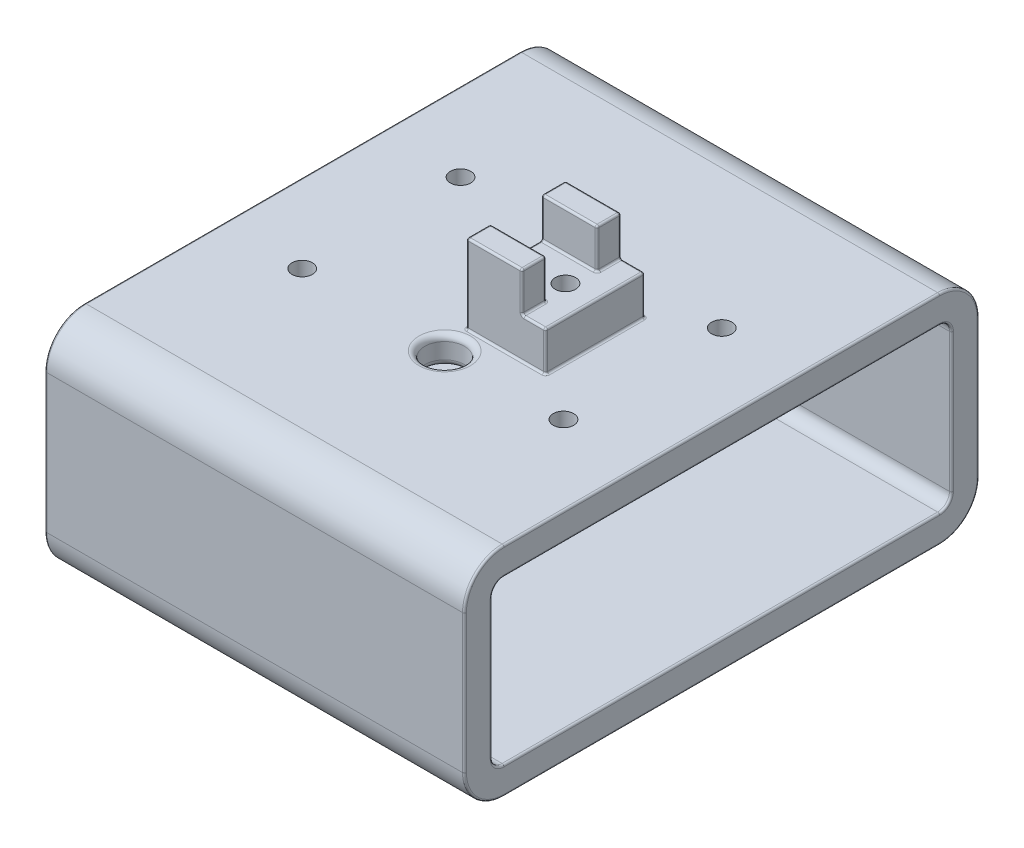
from build123d import *

# Parameters (mm, degrees)
BOSS_EXTRUDE1_DEPTH = 106
SHELL1_T            = -7
SKETCH2_W           = 20
SKETCH2_H           = 25
BOSS_EXTRUDE2_DEPTH = 10
SKETCH3_W           = 14.041332882
SKETCH3_H           = 6.05
BOSS_EXTRUDE3_DEPTH = 10
SKETCH4_R           = 2.575
CUT_EXTRUDE1_DEPTH  = 17
SKETCH5_R           = 2.575
CUT_EXTRUDE2_DEPTH  = 7
FILLET1_R           = 0.5
SKETCH6_W           = 14.6
SKETCH6_H           = 8.42
CUT_EXTRUDE3_DEPTH  = 7
SKETCH7_R           = 5
CUT_EXTRUDE4_DEPTH  = 7
SKETCH8_R           = 6
CUT_EXTRUDE5_DEPTH  = 7
FILLET2_R           = 0.5
FILLET4_R           = 1.5


with BuildPart() as part:
    # Sketch1 → Boss-Extrude1 (new body)
    with BuildSketch(Plane(origin=(0, 0, 0), x_dir=(0, 0, -1), z_dir=(1, 0, 0))):
        with BuildLine():
            Line((-10, 0), (-120, 0))
            ThreePointArc((-120, 0), (-127.071067812, -2.928932188), (-130, -10))
            Line((-130, -10), (-130, -45))
            ThreePointArc((-130, -45), (-127.071067812, -52.071067812), (-120, -55))
            Line((-120, -55), (-10, -55))
            ThreePointArc((-10, -55), (-2.928932188, -52.071067812), (0, -45))
            Line((0, -45), (0, -10))
            ThreePointArc((0, -10), (-2.928932188, -2.928932188), (-10, 0))
        make_face()
    extrude(amount=BOSS_EXTRUDE1_DEPTH)

    # Shell1
    shell1_openings = [part.faces().sort_by_distance(p)[0] for p in [
        (106, -27.5, 65),
    ]]
    offset(amount=SHELL1_T, openings=shell1_openings, kind=Kind.INTERSECTION)

    # Sketch2 → Boss-Extrude2 (add)
    with BuildSketch(Plane(origin=(0, 0, 0), x_dir=(1, 0, 0), z_dir=(0, 1, 0))):
        with Locations((64, -65)):
            Rectangle(SKETCH2_W, SKETCH2_H)
    extrude(amount=BOSS_EXTRUDE2_DEPTH)

    # Sketch3 → Boss-Extrude3 (add)
    with BuildSketch(Plane(origin=(0, 10, 0), x_dir=(1, 0, 0), z_dir=(0, 1, 0))):
        with Locations((61.020666441, -74.475)):
            Rectangle(SKETCH3_W, SKETCH3_H)
        with Locations((61.020666441, -55.525)):
            Rectangle(SKETCH3_W, SKETCH3_H)
    extrude(amount=BOSS_EXTRUDE3_DEPTH)

    # Sketch4 → Cut-Extrude1 (cut)
    with BuildSketch(Plane(origin=(0, 10, 0), x_dir=(1, 0, 0), z_dir=(0, 1, 0))):
        with Locations(Location((66.5, -65, 0), (0, 0, 270))):
            Circle(SKETCH4_R)
    extrude(amount=-CUT_EXTRUDE1_DEPTH, mode=Mode.SUBTRACT)

    # Sketch5 → Cut-Extrude2 (cut)
    with BuildSketch(Plane(origin=(0, 0, 0), x_dir=(1, 0, 0), z_dir=(0, 1, 0))):
        with Locations(Location((20, -85, 0), (0, 0, 270))):
            Circle(SKETCH5_R)
        with Locations(Location((20, -45, 0), (0, 0, 270))):
            Circle(SKETCH5_R)
        with Locations(Location((86, -45, 0), (0, 0, 270))):
            Circle(SKETCH5_R)
        with Locations(Location((86, -85, 0), (0, 0, 270))):
            Circle(SKETCH5_R)
    extrude(amount=-CUT_EXTRUDE2_DEPTH, mode=Mode.SUBTRACT)

    # Fillet1
    fillet1_edges = [part.edges().sort_by_distance(p)[0] for p in [
        (74, 0, 65),
        (74, 5, 77.5),
        (64, 0, 52.5),
        (74, 5, 52.5),
        (54, 0, 65),
        (54, 10, 52.5),
        (64, 0, 77.5),
        (54, 10, 77.5),
        (74, 10, 65),
        (71.020666441, 10, 52.5),
        (71.020666441, 10, 77.5),
        (54, 15, 71.45),
        (68.041332882, 10, 74.475),
        (68.041332882, 15, 77.5),
        (61.020666441, 10, 71.45),
        (68.041332882, 15, 71.45),
        (54, 20, 74.475),
        (61.020666441, 20, 77.5),
        (68.041332882, 20, 74.475),
        (61.020666441, 20, 71.45),
        (54, 10, 65),
        (61.020666441, 10, 58.55),
        (54, 15, 58.55),
        (68.041332882, 10, 55.525),
        (68.041332882, 15, 58.55),
        (68.041332882, 15, 52.5),
        (54, 20, 55.525),
        (61.020666441, 20, 58.55),
        (68.041332882, 20, 55.525),
        (61.020666441, 20, 52.5),
    ]]
    fillet(fillet1_edges, radius=FILLET1_R)

    # Sketch6 → Cut-Extrude3 (cut)
    with BuildSketch(Plane(origin=(0, 0, 0), x_dir=(-1, 0, 0), z_dir=(0, 0, -1))):
        with Locations((-58.7, -24.21)):
            Rectangle(SKETCH6_W, SKETCH6_H)
    extrude(amount=-CUT_EXTRUDE3_DEPTH, mode=Mode.SUBTRACT)

    # Sketch7 → Cut-Extrude4 (cut)
    with BuildSketch(Plane(origin=(0, 0, 0), x_dir=(1, 0, 0), z_dir=(0, 1, 0))):
        with Locations(Location((56, -85, 0), (0, 0, 270))):
            Circle(SKETCH7_R)
    extrude(amount=-CUT_EXTRUDE4_DEPTH, mode=Mode.SUBTRACT)

    # Sketch8 → Cut-Extrude5 (cut)
    with BuildSketch(Plane.ZY):
        with Locations((65, -15)):
            Circle(SKETCH8_R)
    extrude(amount=-CUT_EXTRUDE5_DEPTH, mode=Mode.SUBTRACT)

    # Fillet2
    fillet2_edges = [part.edges().sort_by_distance(p)[0] for p in [
        (0, -27.5, 130),
        (0, -2.928932188, 127.071067812),
        (0, 0, 65),
        (0, -2.928932188, 2.928932188),
        (106, -2.928932188, 127.071067812),
        (106, -27.5, 130),
        (106, -52.071067812, 127.071067812),
        (106, -55, 65),
        (106, -52.071067812, 2.928932188),
        (106, -7.878679656, 7.878679656),
        (106, -7, 65),
        (106, -7.878679656, 122.121320344),
        (106, -27.5, 123),
        (106, -47.121320344, 122.121320344),
        (106, -48, 65),
        (106, -47.121320344, 7.878679656),
        (106, -27.5, 7),
        (106, -27.5, 0),
        (106, -2.928932188, 2.928932188),
        (0, -27.5, 0),
        (106, 0, 65),
        (0, -52.071067812, 2.928932188),
        (0, -55, 65),
        (0, -52.071067812, 127.071067812),
    ]]
    fillet(fillet2_edges, radius=FILLET2_R)

    # Fillet4
    fillet4_edges = [part.edges().sort_by_distance(p)[0] for p in [
        (56, 0, 80),
        (56, -7, 80),
        (0, -15, 59),
        (7, -15, 59),
    ]]
    fillet(fillet4_edges, radius=FILLET4_R)


solid = part.part
